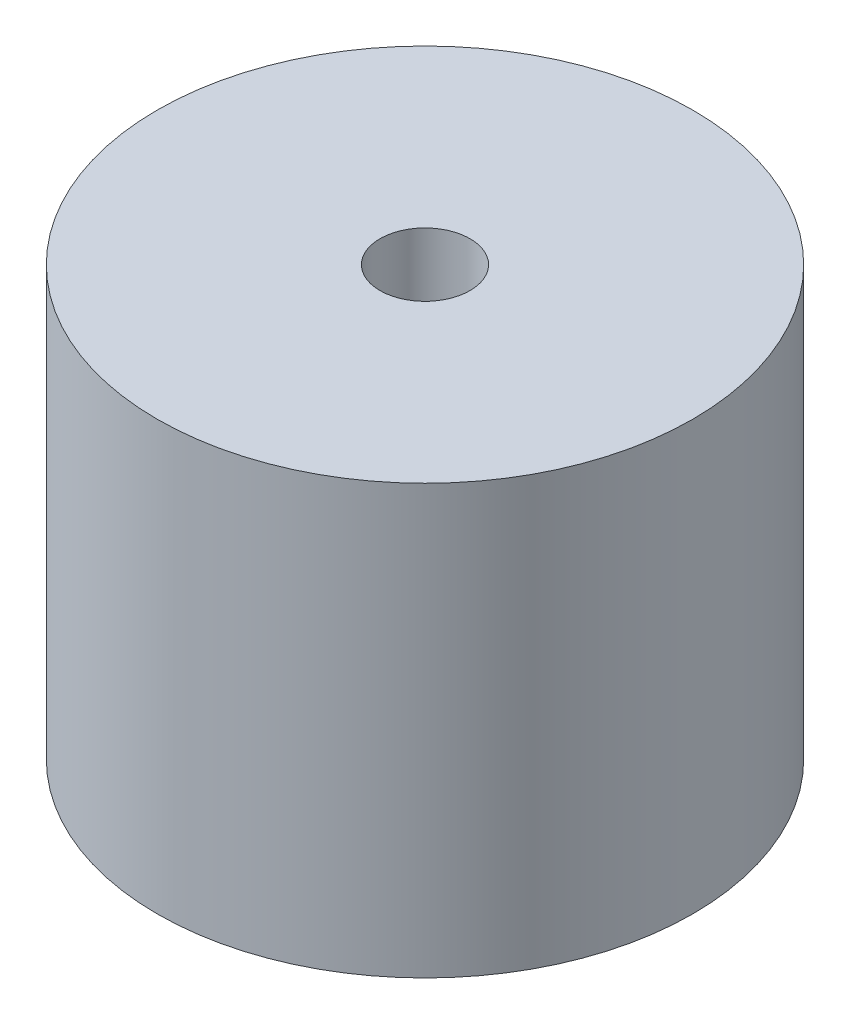
from build123d import *

# Parameters (mm, degrees)
SKETCH_1_R          = 12.5
EXTRUDE_1_DEPTH     = 20
SKETCH_2_R          = 10.5
SKETCH_2_R_2        = 6
CUT_EXTRUDE_1_DEPTH = 1
SKETCH_3_R          = 2.1
CUT_EXTRUDE_2_DEPTH = 10


with BuildPart() as part:
    # 草图1 → 凸台-拉伸1 (new body)
    with BuildSketch(Plane(origin=(0, 0, 0), x_dir=(1, 0, 0), z_dir=(0, 1, 0))):
        with Locations(Location((0, 0, 0), (0, 0, 270))):
            Circle(SKETCH_1_R)
    extrude(amount=EXTRUDE_1_DEPTH)

    # 草图2 → 切除-拉伸1 (cut)
    with BuildSketch(Plane.XZ):
        with Locations(Location((0, 0, 0), (0, 0, 270))):
            Circle(SKETCH_2_R)
        with Locations(Location((0, 0, 0), (0, 0, 270))):
            Circle(SKETCH_2_R_2, mode=Mode.SUBTRACT)
    extrude(amount=-CUT_EXTRUDE_1_DEPTH, mode=Mode.SUBTRACT)

    # 草图3 → 切除-拉伸2 (cut)
    with BuildSketch(Plane(origin=(0, 20, 0), x_dir=(1, 0, 0), z_dir=(0, 1, 0))):
        with Locations(Location((0, 0, 0), (0, 0, 270))):
            Circle(SKETCH_3_R)
    extrude(amount=-CUT_EXTRUDE_2_DEPTH, mode=Mode.SUBTRACT)


solid = part.part
